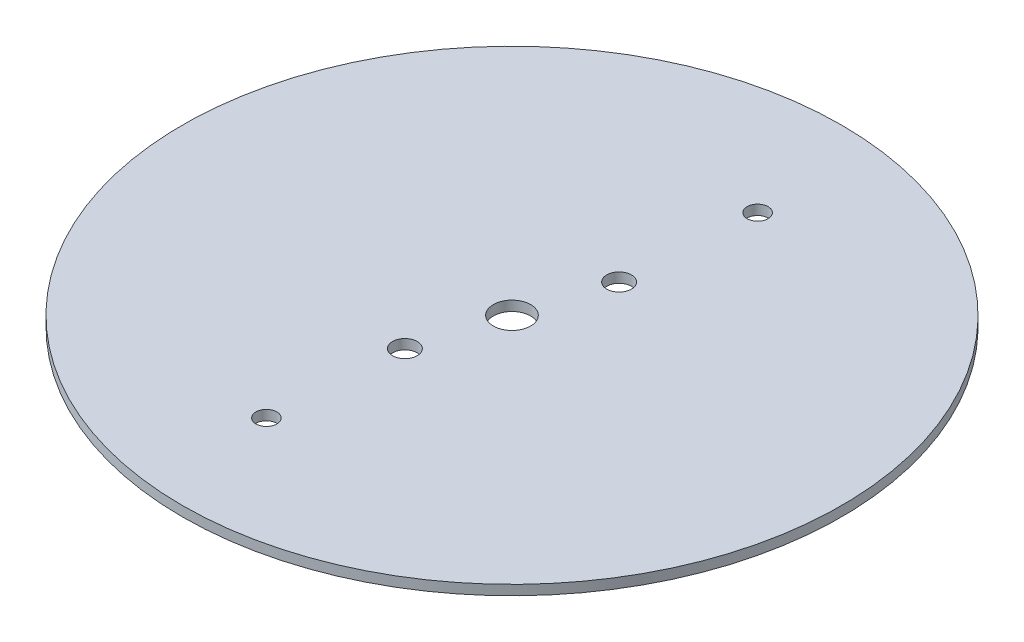
from build123d import *

# Parameters (mm, degrees)
SKETCH1_R   = 20
SKETCH1_R_2 = 1.1303
SKETCH1_R_3 = 0.75
SKETCH1_R_4 = 0.635
PCB_DEPTH   = 0.6


with BuildPart() as part:
    # Sketch1 → PCB (new body)
    with BuildSketch(Plane(origin=(0, 0, 0), x_dir=(1, 0, 0), z_dir=(0, 1, 0))):
        with Locations(Location((0, 0, 0), (0, 0, 270))):
            Circle(SKETCH1_R)
        with Locations(Location((0, 0, 0), (0, 0, 270))):
            Circle(SKETCH1_R_2, mode=Mode.SUBTRACT)
        with Locations(Location((1.5, 5, 0), (0, 0, 270))):
            Circle(SKETCH1_R_3, mode=Mode.SUBTRACT)
        with Locations(Location((-1.5, -5, 0), (0, 0, 270))):
            Circle(SKETCH1_R_3, mode=Mode.SUBTRACT)
        with Locations(Location((2.05801875, 12.846715625, 0), (0, 0, 270))):
            Circle(SKETCH1_R_4, mode=Mode.SUBTRACT)
        with Locations(Location((-2.05801875, -12.846715625, 0), (0, 0, 270))):
            Circle(SKETCH1_R_4, mode=Mode.SUBTRACT)
    extrude(amount=PCB_DEPTH)


solid = part.part
